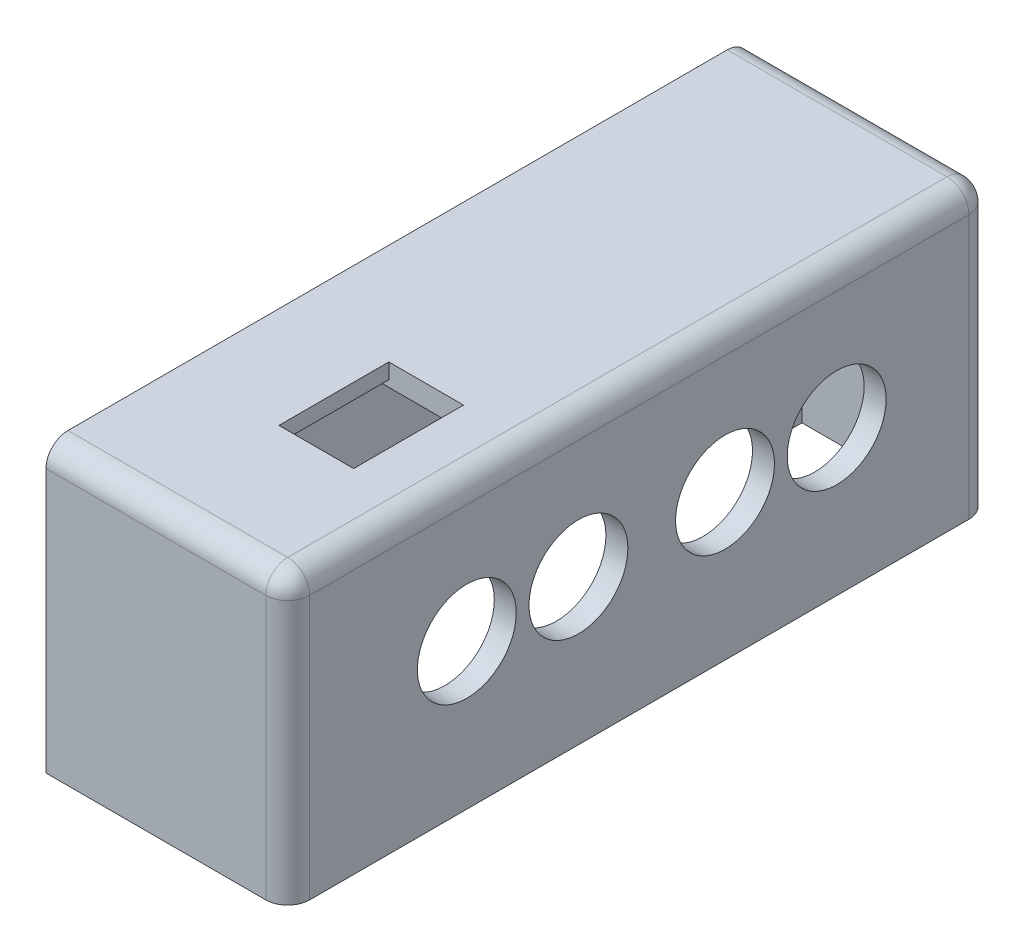
from build123d import *

# Parameters (mm, degrees)
SKETCH_1_W          = 160
SKETCH_1_H          = 65
EXTRUDE_1_DEPTH     = 55
CUT_EXTRUDE_3_DEPTH = 60
SKETCH_6_W          = 17
SKETCH_6_H          = 25
CUT_EXTRUDE_4_DEPTH = 60
SKETCH_7_W          = 27
SKETCH_7_H          = 25
CUT_EXTRUDE_5_DEPTH = 1.5
SKETCH_9_R          = 11.25
CUT_EXTRUDE_6_DEPTH = 10
FILLET_3_R          = 5
CUT_EXTRUDE_7_DEPTH = 2.34
SKETCH_12_R         = 1.5
CUT_EXTRUDE_8_DEPTH = 4


with BuildPart() as part:
    # Эскиз1 → Бобышка-Вытянуть1 (new body)
    with BuildSketch(Plane(origin=(0, 0, 0), x_dir=(0, 0, -1), z_dir=(1, 0, 0))):
        Rectangle(SKETCH_1_W, SKETCH_1_H)
    extrude(amount=EXTRUDE_1_DEPTH)

    # Эскиз2 → Вырез-Вытянуть3 (cut)
    with BuildSketch(Plane.XZ.offset(32.5)):
        Polygon((5, -71), (10, -71), (13, -71), (13, -75), (14, -75), (14, -71), (17, -71), (17, -75), (37, -75), (37, -71), (40, -71), (40, -75), (41, -75), (41, -71), (44, -71), (50, -71), (50, 71), (44, 71), (41, 71), (41, 75), (40, 75), (40, 71), (37, 71), (37, 75), (17, 75), (17, 71), (14, 71), (14, 75), (13, 75), (13, 71), (10, 71), (5, 71), align=None)
    extrude(amount=-CUT_EXTRUDE_3_DEPTH, mode=Mode.SUBTRACT)

    # Эскиз6 → Вырез-Вытянуть4 (cut)
    with BuildSketch(Plane(origin=(0, 32.5, 0), x_dir=(1, 0, 0), z_dir=(0, 1, 0))):
        with Locations((31.5, -37.5)):
            Rectangle(SKETCH_6_W, SKETCH_6_H)
    extrude(amount=-CUT_EXTRUDE_4_DEPTH, mode=Mode.SUBTRACT)

    # Эскиз7 → Вырез-Вытянуть5 (cut)
    with BuildSketch(Plane.XZ.offset(-27.5)):
        with Locations((31.5, 37.5)):
            Rectangle(SKETCH_7_W, SKETCH_7_H)
    extrude(amount=-CUT_EXTRUDE_5_DEPTH, mode=Mode.SUBTRACT)

    # Эскиз9 → Вырез-Вытянуть6 (cut)
    with BuildSketch(Plane(origin=(55, 0, 0), x_dir=(0, 0, -1), z_dir=(1, 0, 0))):
        with Locations((-39.25, 0.6)):
            Circle(SKETCH_9_R)
        with Locations((19.503, 0.6)):
            Circle(SKETCH_9_R)
        with Locations((44.903, 0.6)):
            Circle(SKETCH_9_R)
        with Locations((-13.85, 0.6)):
            Circle(SKETCH_9_R)
    extrude(amount=-CUT_EXTRUDE_6_DEPTH, mode=Mode.SUBTRACT)

    # Скругление3
    fillet_3_edges = [part.edges().sort_by_distance(p)[0] for p in [
        (55, 0, -80),
        (55, 0, 80),
        (27.5, 32.5, -80),
        (27.5, 32.5, 80),
        (55, 32.5, 0),
    ]]
    fillet(fillet_3_edges, radius=FILLET_3_R)

    # Эскиз10 → Вырез-Вытянуть7 (cut)
    with BuildSketch(Plane.XZ.offset(32.5)):
        Polygon((51.558845727, 72.3), (53.117691454, 75), (51.558845727, 77.7), (48.441154273, 77.7), (46.882308546, 75), (48.441154273, 72.3), align=None)
        Polygon((6.558845727, 72.3), (8.117691454, 75), (6.558845727, 77.7), (3.441154273, 77.7), (1.882308546, 75), (3.441154273, 72.3), align=None)
        Polygon((8.117691454, -75), (6.558845727, -72.3), (3.441154273, -72.3), (1.882308546, -75), (3.441154273, -77.7), (6.558845727, -77.7), align=None)
        Polygon((51.558845727, -77.7), (53.117691454, -75), (51.558845727, -72.3), (48.441154273, -72.3), (46.882308546, -75), (48.441154273, -77.7), align=None)
    extrude(amount=-CUT_EXTRUDE_7_DEPTH, mode=Mode.SUBTRACT)

    # Эскиз12 → Вырез-Вытянуть8 (cut)
    with BuildSketch(Plane.XZ.offset(32.5)):
        with Locations(Location((50, 75, 0), (0, 0, 270))):
            Circle(SKETCH_12_R)
        with Locations(Location((50, -75, 0), (0, 0, 270))):
            Circle(SKETCH_12_R)
        with Locations(Location((5, -75, 0), (0, 0, 270))):
            Circle(SKETCH_12_R)
        with Locations(Location((5, 75, 0), (0, 0, 270))):
            Circle(SKETCH_12_R)
    extrude(amount=-CUT_EXTRUDE_8_DEPTH, mode=Mode.SUBTRACT)


solid = part.part
